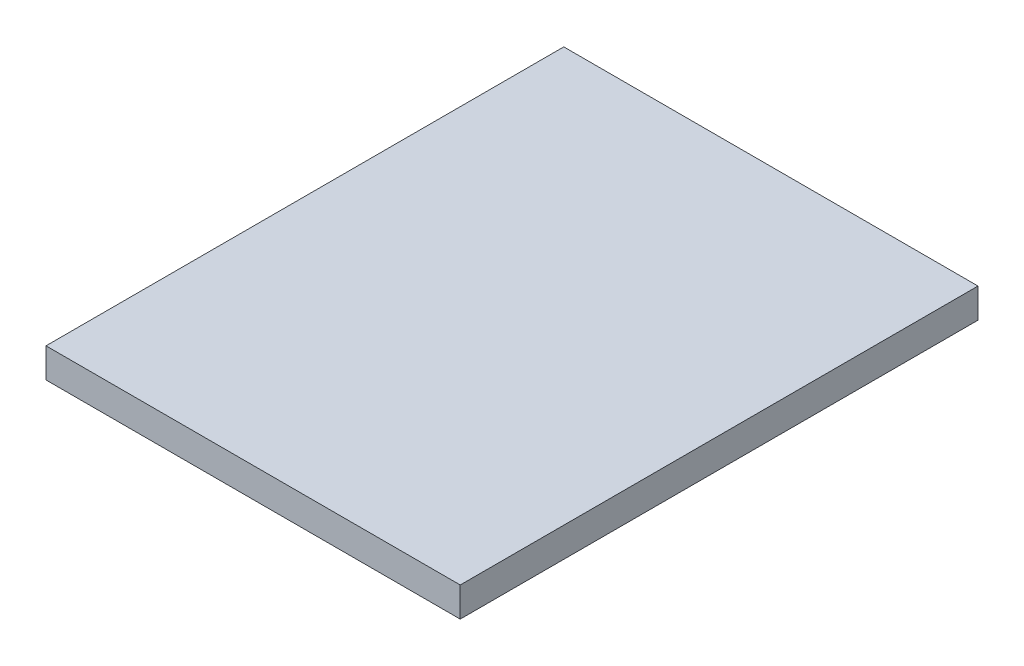
from build123d import *

# Parameters (mm, degrees)
SKETCH2_W      = 355.6
SKETCH2_H      = 444.5
EXTRUDE2_DEPTH = 25.4


with BuildPart() as part:
    # Sketch2 → Extrude2 (new body)
    with BuildSketch(Plane(origin=(0, 0, 0), x_dir=(1, 0, 0), z_dir=(0, 1, 0))):
        with Locations((0, 222.25)):
            Rectangle(SKETCH2_W, SKETCH2_H)
    extrude(amount=EXTRUDE2_DEPTH)


solid = part.part
